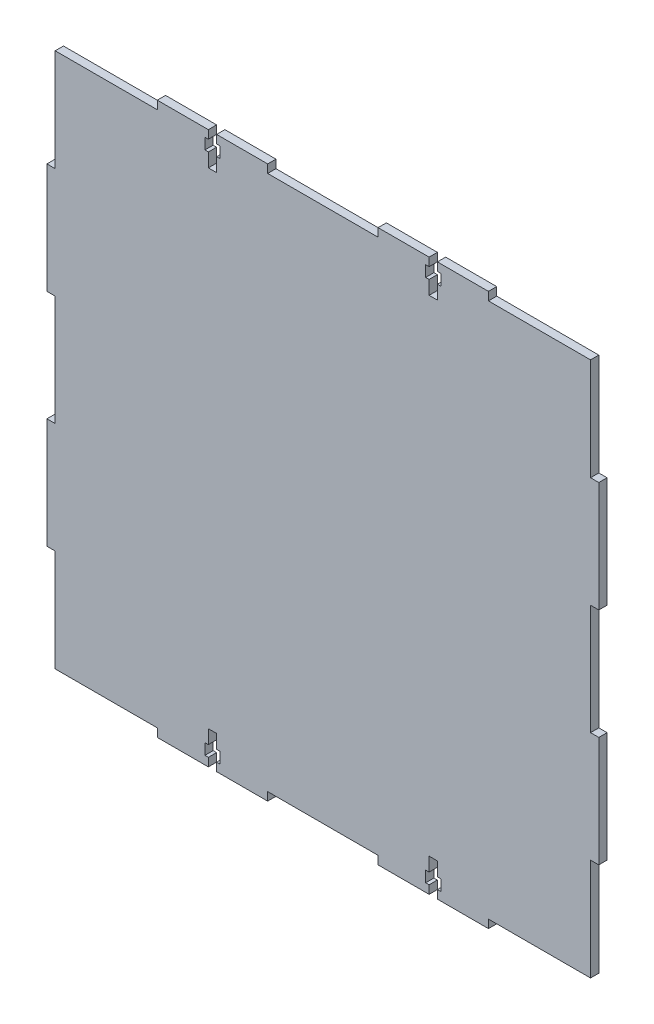
from build123d import *

# Parameters (mm, degrees)
EXTRUDE_1_DEPTH = 3


with BuildPart() as part:
    # 草图1 → 凸台-拉伸1 (new body)
    with BuildSketch(Plane.XY):
        Polygon((120, -3), (80, -3), (80, 0), (61.5, 0), (61.5, -3), (62.75, -3), (62.75, -7), (61.5, -7), (61.5, -12), (58.5, -12), (58.5, -7), (57.25, -7), (57.25, -3), (58.5, -3), (58.5, 0), (40, 0), (40, -3), (3, -3), (3, -40), (0, -40), (0, -80), (3, -80), (3, -120), (0, -120), (0, -160), (3, -160), (3, -197), (40, -197), (40, -200), (58.5, -200), (58.5, -197), (57.25, -197), (57.25, -193), (58.5, -193), (58.5, -188), (61.5, -188), (61.5, -193), (62.75, -193), (62.75, -197), (61.5, -197), (61.5, -200), (80, -200), (80, -197), (120, -197), (120, -200), (138.5, -200), (138.5, -197), (137.25, -197), (137.25, -193), (138.5, -193), (138.5, -188), (141.5, -188), (141.5, -193), (142.75, -193), (142.75, -197), (141.5, -197), (141.5, -200), (160, -200), (160, -197), (197, -197), (197, -160), (200, -160), (200, -120), (197, -120), (197, -80), (200, -80), (200, -40), (197, -40), (197, -3), (160, -3), (160, 0), (141.5, 0), (141.5, -3), (142.75, -3), (142.75, -7), (141.5, -7), (141.5, -12), (138.5, -12), (138.5, -7), (137.25, -7), (137.25, -3), (138.5, -3), (138.5, 0), (120, 0), align=None)
    extrude(amount=EXTRUDE_1_DEPTH)


solid = part.part
